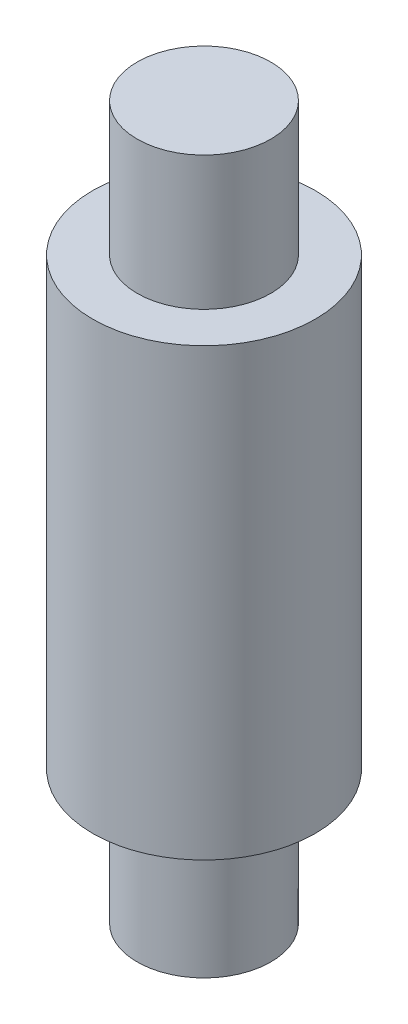
from build123d import *

# Parameters (mm, degrees)
SKETCH_1_R      = 2.5
EXTRUDE_2_DEPTH = 5
SKETCH_2_R      = 1.5
EXTRUDE_3_DEPTH = 3
EXTRUDE_START   = 3
SKETCH_3_R      = 1.5
EXTRUDE_4_DEPTH = 3


with BuildPart() as part:
    # 草图1 → 凸台-拉伸2 (new, symmetric)
    with BuildSketch(Plane(origin=(0, 0, 0), x_dir=(1, 0, 0), z_dir=(0, 1, 0))):
        with Locations(Location((0, 0, 0), (0, 0, 270))):
            Circle(SKETCH_1_R)
    extrude(amount=EXTRUDE_2_DEPTH, both=True)

    # 草图2 → 凸台-拉伸3 (add)
    with BuildSketch(Plane(origin=(0, 5, 0), x_dir=(1, 0, 0), z_dir=(0, 1, 0))):
        with Locations(Location((0, 0, 0), (0, 0, 270))):
            Circle(SKETCH_2_R)
    extrude(amount=EXTRUDE_3_DEPTH)

    # 草图3 → 凸台-拉伸4 (add)
    with BuildSketch(Plane.XZ.offset(5).offset(EXTRUDE_START)):
        with Locations(Location((0, 0, 0), (0, 0, 90))):
            Circle(SKETCH_3_R)
    extrude(amount=-EXTRUDE_4_DEPTH)


solid = part.part
